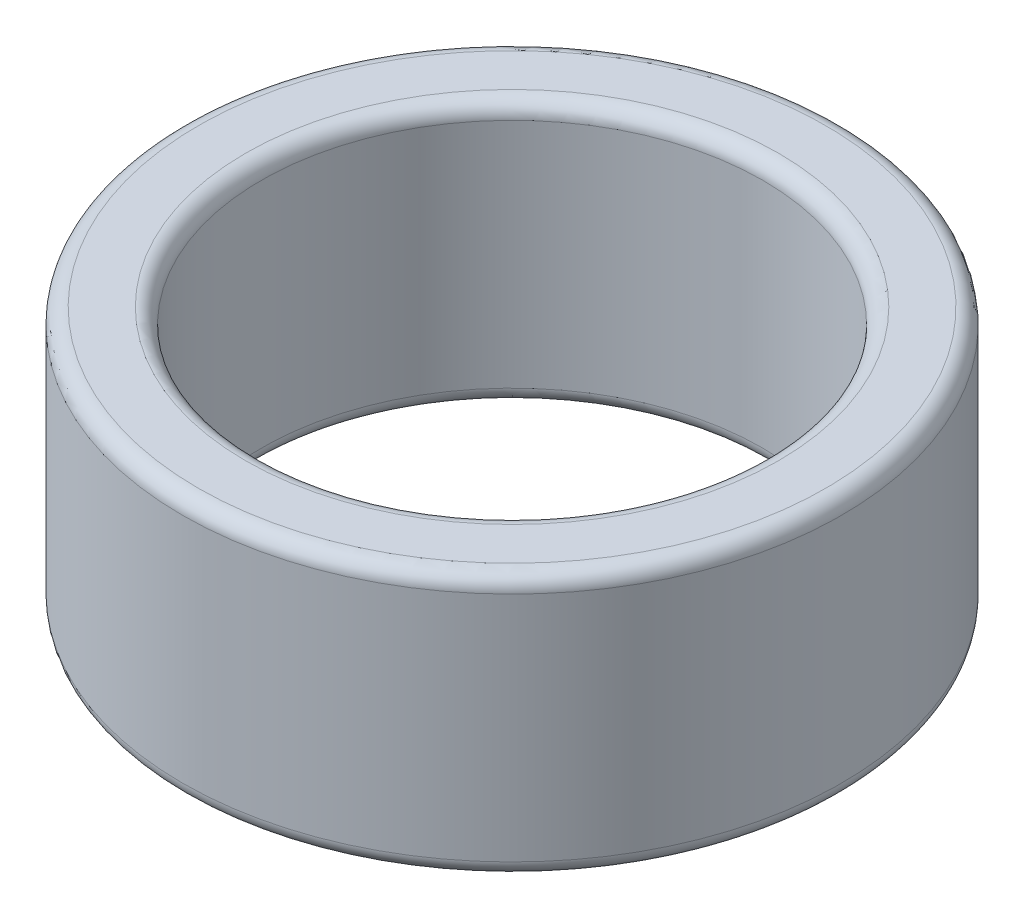
from build123d import *

# Parameters (mm, degrees)
SKETCH1_R           = 5.2575
SKETCH1_R_2         = 4
BOSS_EXTRUDE1_DEPTH = 4.2
FILLET1_R           = 0.25


with BuildPart() as part:
    # Sketch1 → Boss-Extrude1 (new body)
    with BuildSketch(Plane(origin=(0, 0, 0), x_dir=(1, 0, 0), z_dir=(0, 1, 0))):
        with Locations(Location((0, 0, 0), (0, 0, 270))):
            Circle(SKETCH1_R)
        with Locations(Location((0, 0, 0), (0, 0, 270))):
            Circle(SKETCH1_R_2, mode=Mode.SUBTRACT)
    extrude(amount=BOSS_EXTRUDE1_DEPTH)

    # Fillet1
    fillet1_edges = [part.edges().sort_by_distance(p)[0] for p in [
        (0, 0, -5.2575),
        (0, 4.2, -5.2575),
        (0, 0, -4),
        (0, 4.2, -4),
    ]]
    fillet(fillet1_edges, radius=FILLET1_R)


solid = part.part
